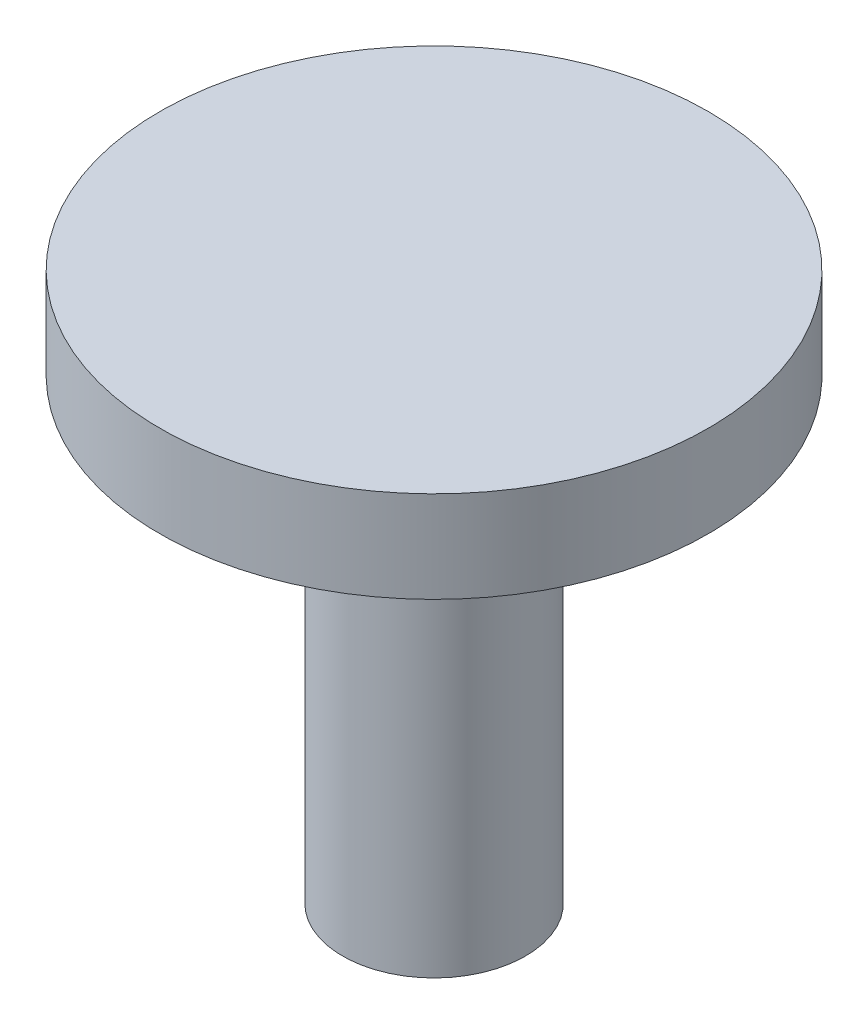
from build123d import *


with BuildPart() as part:
    # Sketch1 → Revolve1 (revolve)
    with BuildSketch(Plane.XY, mode=Mode.PRIVATE) as revolve1_sk:
        Polygon((0, 0), (0, 30), (15, 30), (15, 25), (5, 25), (5, 0), align=None)
    revolve(revolve1_sk.sketch.rotate(Axis((0, 0, 0), (0, 1, 0)), 90), axis=Axis((0, 0, 0), (0, 1, 0)))


solid = part.part
